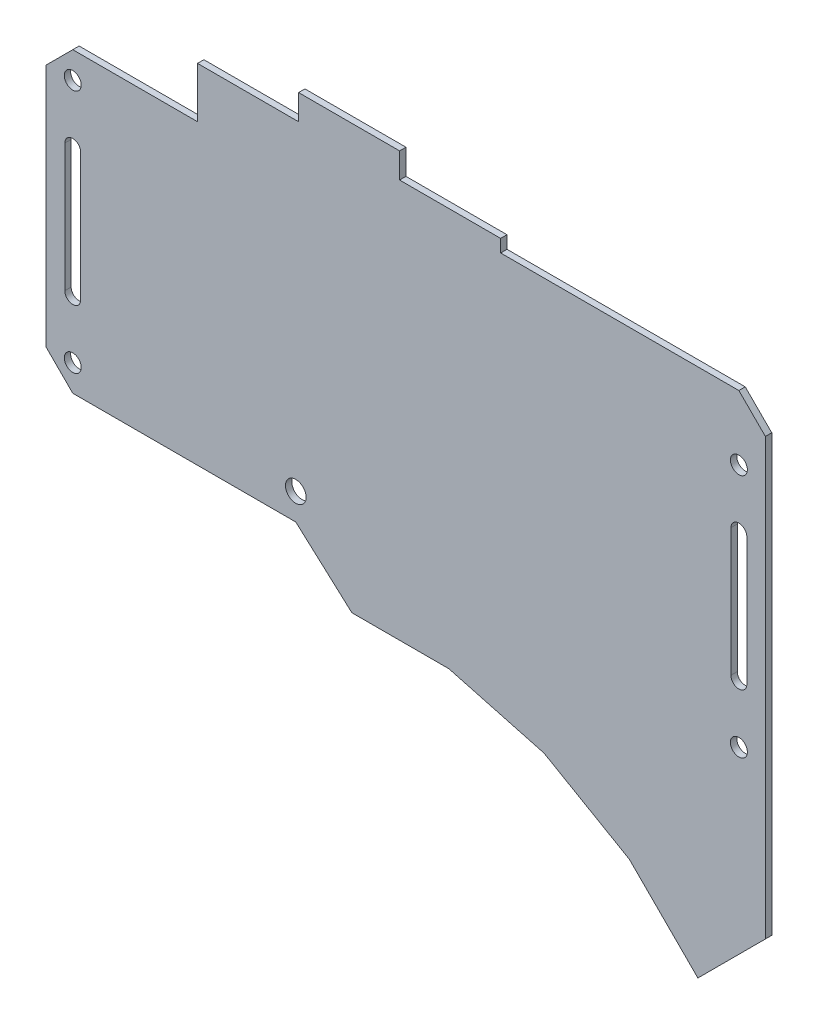
from build123d import *

# Parameters (mm, degrees)
ESQUISSE2_R        = 1.6
ESQUISSE2_R_2      = 1.948326961
BOSS_EXTRU_1_DEPTH = 1.2


with BuildPart() as part:
    # Esquisse2 → Boss.-Extru.1 (new body)
    with BuildSketch(Plane.XY):
        Polygon((38.19435, 93.5719), (14.6697, 93.5719), (9.6697, 88.5719), (9.6697, 42.4727), (14.6697, 37.4727), (56.719, 37.4727), (67.2947, 27.9475), (85.586462681, 27.9475), (103.516430018, 23.142256556), (119.601627139, 13.856517967), (132.532309311, 0.926057837), (145.259827189, 13.653794272), (145.259827189, 95.7157), (140.259827189, 100.7157), (95.34435, 100.7157), (95.34435, 103.097), (76.29435, 103.097), (76.29435, 107.859), (57.24435, 107.859), (57.24435, 103.097), (38.19435, 103.097), align=None)
        with Locations((14.6697, 42.4727)):
            Circle(ESQUISSE2_R, mode=Mode.SUBTRACT)
        with Locations((14.6697, 88.5719)):
            Circle(ESQUISSE2_R, mode=Mode.SUBTRACT)
        with Locations((140.259827189, 88.5719)):
            Circle(ESQUISSE2_R, mode=Mode.SUBTRACT)
        with Locations((140.259827189, 42.4727)):
            Circle(ESQUISSE2_R, mode=Mode.SUBTRACT)
        with Locations((56.719, 42.4727)):
            Circle(ESQUISSE2_R_2, mode=Mode.SUBTRACT)
        with BuildLine():
            Line((16.1697, 77.5727), (16.1697, 53.4719))
            ThreePointArc((16.1697, 53.4719), (14.6697, 51.9719), (13.1697, 53.4719))
            Line((13.1697, 53.4719), (13.1697, 77.5727))
            ThreePointArc((13.1697, 77.5727), (14.6697, 79.0727), (16.1697, 77.5727))
        make_face(mode=Mode.SUBTRACT)
        with BuildLine():
            Line((141.759827189, 77.5727), (141.759827189, 53.4719))
            ThreePointArc((141.759827189, 53.4719), (140.259827189, 51.9719), (138.759827189, 53.4719))
            Line((138.759827189, 53.4719), (138.759827189, 77.5727))
            ThreePointArc((138.759827189, 77.5727), (140.259827189, 79.0727), (141.759827189, 77.5727))
        make_face(mode=Mode.SUBTRACT)
    extrude(amount=BOSS_EXTRU_1_DEPTH)


solid = part.part
